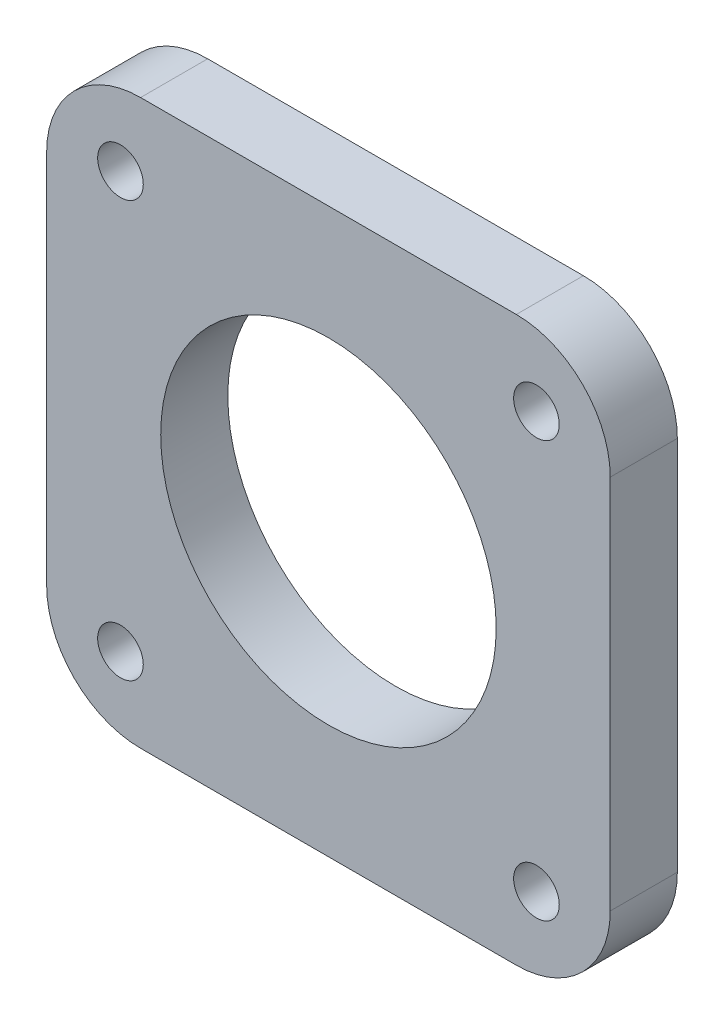
from build123d import *

# Parameters (mm, degrees)
SKETCH_1_W      = 42
SKETCH_1_H      = 42
SKETCH_1_R      = 12.5
SKETCH_1_R_2    = 1.7
EXTRUDE_1_DEPTH = 5
FILLET_1_R      = 7


with BuildPart() as part:
    # 草图1 → 凸台-拉伸1 (new body)
    with BuildSketch(Plane.XY):
        Rectangle(SKETCH_1_W, SKETCH_1_H)
        Circle(SKETCH_1_R, mode=Mode.SUBTRACT)
        with Locations((-15.5, -15.5)):
            Circle(SKETCH_1_R_2, mode=Mode.SUBTRACT)
        with Locations((15.5, -15.5)):
            Circle(SKETCH_1_R_2, mode=Mode.SUBTRACT)
        with Locations((15.5, 15.5)):
            Circle(SKETCH_1_R_2, mode=Mode.SUBTRACT)
        with Locations((-15.5, 15.5)):
            Circle(SKETCH_1_R_2, mode=Mode.SUBTRACT)
    extrude(amount=EXTRUDE_1_DEPTH)

    # 圆角1
    fillet_1_edges = [part.edges().sort_by_distance(p)[0] for p in [
        (21, -21, 2.5),
        (-21, -21, 2.5),
        (-21, 21, 2.5),
        (21, 21, 2.5),
    ]]
    fillet(fillet_1_edges, radius=FILLET_1_R)


solid = part.part
